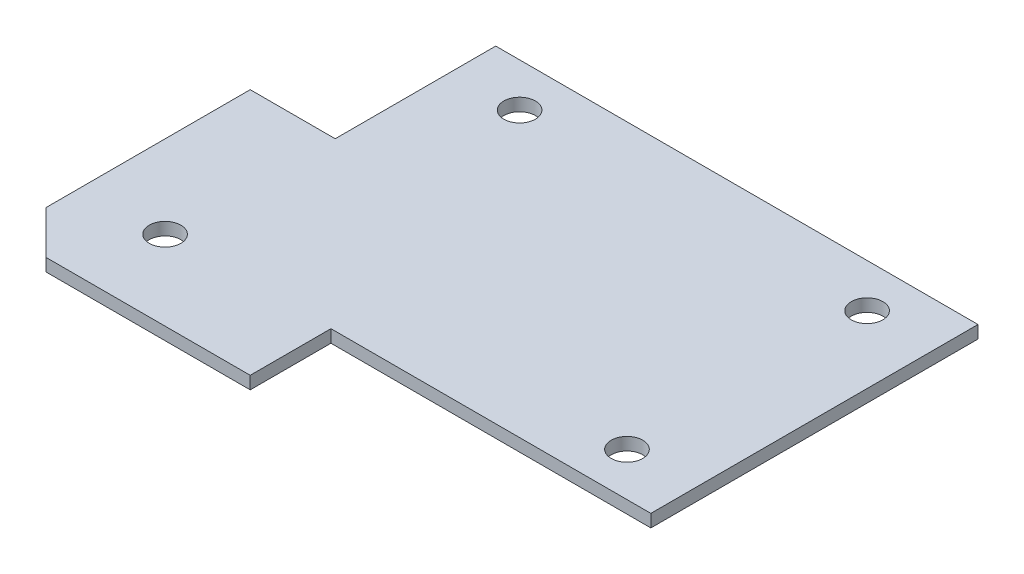
from build123d import *

# Parameters (mm, degrees)
BOSS_EXTRUDE1_DEPTH = 2
CHAMFER1_SIZE       = 8
BOSS_EXTRUDE2_DEPTH = 2
SKETCH4_W           = 99.768826376
SKETCH4_H           = 91.588754032
CUT_EXTRUDE1_DEPTH  = 2
SKETCH5_R           = 2.5
CUT_EXTRUDE2_DEPTH  = 2
SKETCH6_W           = 15
SKETCH6_H           = 51.780584955
BOSS_EXTRUDE3_DEPTH = 2
SKETCH7_R           = 2.5
CUT_EXTRUDE3_DEPTH  = 62.071622078
SKETCH8_R           = 3.630325665
SKETCH8_R_2         = 3.812865601
BOSS_EXTRUDE4_DEPTH = 2


with BuildPart() as part:
    # Sketch1 → Boss-Extrude1 (new body)
    with BuildSketch(Plane(origin=(0, 0, 0), x_dir=(1, 0, 0), z_dir=(0, 1, 0))):
        Polygon((-1.782487159, -28.34466675), (33.85093234, -28.34466675), (33.85093234, 27.435918205), (-31.480603593, 27.435918205), (-31.480603593, 2.026433414), (-44.933505709, 2.026433414), (-44.933505709, -41.124585136), (-1.782487159, -41.124585136), align=None)
    extrude(amount=BOSS_EXTRUDE1_DEPTH)

    # Chamfer1
    chamfer1_edges = [part.edges().sort_by_distance(p)[0] for p in [
        (-44.933505709, 1, 41.124585136),
    ]]
    chamfer(chamfer1_edges, length=CHAMFER1_SIZE)

    # Sketch3 → Boss-Extrude2 (add)
    with BuildSketch(Plane(origin=(0, 2, 0), x_dir=(1, 0, 0), z_dir=(0, 1, 0))):
        Polygon((-29.480603593, 25.435918205), (31.85093234, 25.435918205), (31.85093234, -26.34466675), (-3.782487159, -26.34466675), (-3.782487159, -39.124585136), (-36.105078585, -39.124585136), (-42.933505709, -32.296158012), (-42.933505709, 0.026433414), (-29.480603593, 0.026433414), align=None)
    extrude(amount=BOSS_EXTRUDE2_DEPTH)

    # Sketch4 → Cut-Extrude1 (cut)
    with BuildSketch(Plane.XZ):
        Rectangle(SKETCH4_W, SKETCH4_H)
    extrude(amount=-CUT_EXTRUDE1_DEPTH, mode=Mode.SUBTRACT)

    # Sketch5 → Cut-Extrude2 (cut)
    with BuildSketch(Plane(origin=(0, 4, 0), x_dir=(1, 0, 0), z_dir=(0, 1, 0))):
        with Locations(Location((-18.814835626, 18.545625727, 0), (0, 0, 270))):
            Circle(SKETCH5_R)
        with Locations(Location((21.185164374, 18.545625727, 0), (0, 0, 270))):
            Circle(SKETCH5_R)
        with Locations(Location((21.185164374, -19.454374273, 0), (0, 0, 270))):
            Circle(SKETCH5_R)
        with Locations(Location((-29.854835626, -26.529137879, 0), (0, 0, 270))):
            Circle(SKETCH5_R)
    extrude(amount=-CUT_EXTRUDE2_DEPTH, mode=Mode.SUBTRACT)

    # Sketch6 → Boss-Extrude3 (add)
    with BuildSketch(Plane(origin=(0, 4, 0), x_dir=(1, 0, 0), z_dir=(0, 1, 0))):
        with Locations((39.35093234, -0.454374273)):
            Rectangle(SKETCH6_W, SKETCH6_H)
    extrude(amount=-BOSS_EXTRUDE3_DEPTH)

    # Sketch7 → Cut-Extrude3 (cut, through all)
    with BuildSketch(Plane(origin=(0, 4, 0), x_dir=(1, 0, 0), z_dir=(0, 1, 0))):
        with Locations(Location((36.185164374, 18.545625727, 0), (0, 0, 270))):
            Circle(SKETCH7_R)
        with Locations(Location((36.185164374, -19.454374273, 0), (0, 0, 270))):
            Circle(SKETCH7_R)
    extrude(amount=-CUT_EXTRUDE3_DEPTH, mode=Mode.SUBTRACT)

    # Sketch8 → Boss-Extrude4 (add)
    with BuildSketch(Plane(origin=(0, 4, 0), x_dir=(1, 0, 0), z_dir=(0, 1, 0))):
        with Locations((21.185164374, 18.545625727)):
            Circle(SKETCH8_R)
        with Locations((21.185164374, -19.454374273)):
            Circle(SKETCH8_R_2)
    extrude(amount=-BOSS_EXTRUDE4_DEPTH)


solid = part.part
